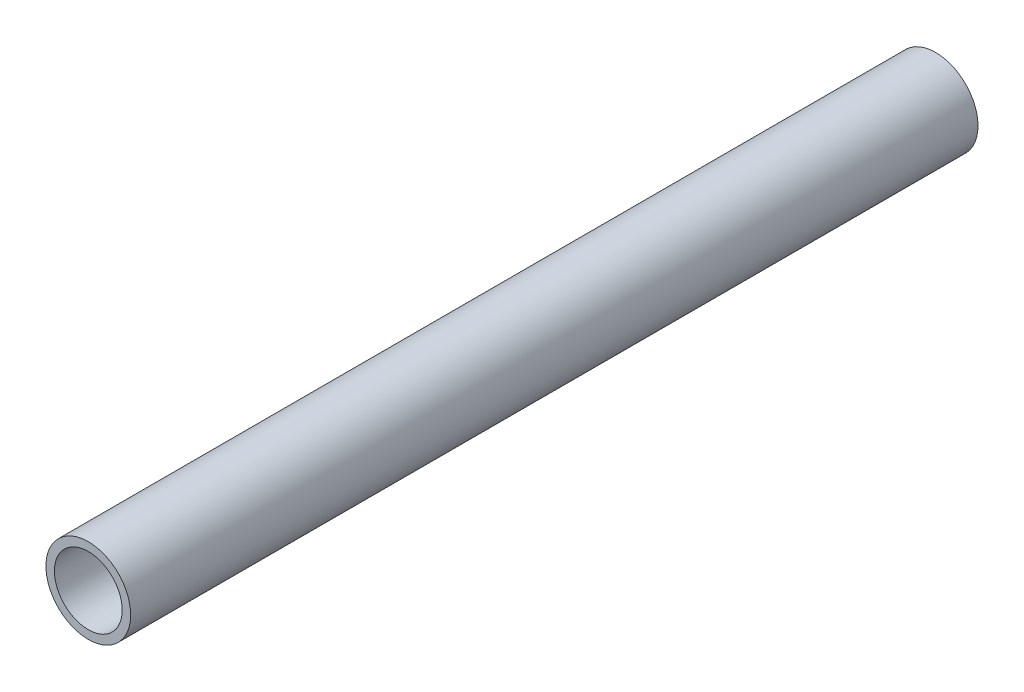
from build123d import *

# Parameters (mm, degrees)
SKIZZE1_R                       = 5
SKIZZE1_R_2                     = 4
AUFSATZ_LINEAR_AUSTRAGEN1_DEPTH = 100


with BuildPart() as part:
    # Skizze1 → Aufsatz-Linear austragen1 (new body)
    with BuildSketch(Plane.XY):
        Circle(SKIZZE1_R)
        Circle(SKIZZE1_R_2, mode=Mode.SUBTRACT)
    extrude(amount=AUFSATZ_LINEAR_AUSTRAGEN1_DEPTH)


solid = part.part
